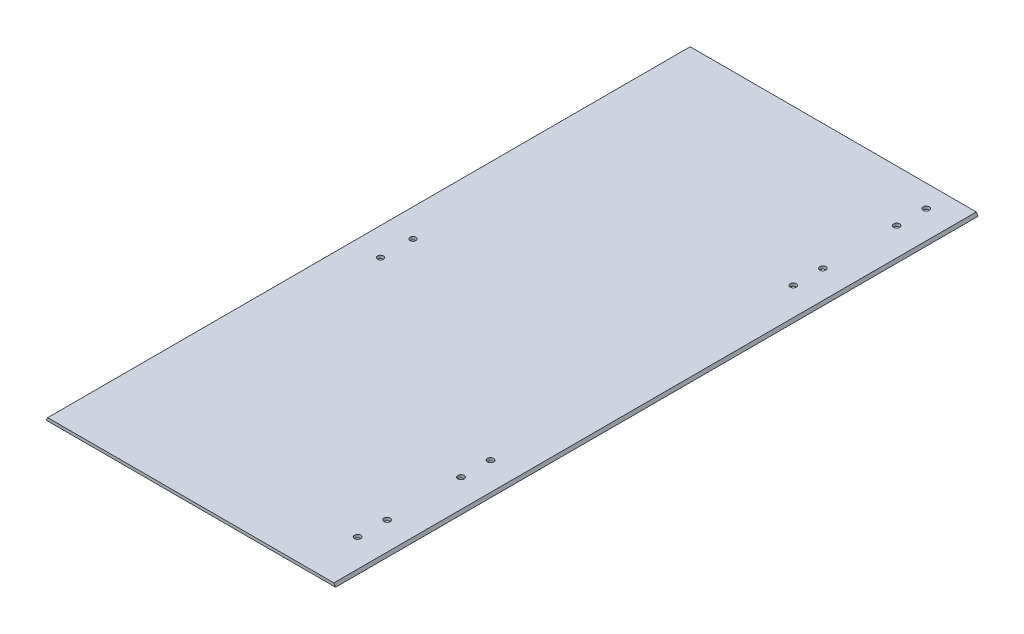
from build123d import *

# Parameters (mm, degrees)
EXTRUDE_1_DEPTH     = 435
SKETCH_3_R          = 2.1
CUT_EXTRUDE_1_DEPTH = 446.922330569
SKETCH_6_R          = 2
CUT_EXTRUDE_2_DEPTH = 446.922330569


with BuildPart() as part:
    # 草图2 → 凸台-拉伸1 (new body)
    with BuildSketch(Plane.XY):
        Polygon((-98, -1), (-96.845299462, 1), (96.915299462, 1), (98.07, -1), align=None)
    extrude(amount=-EXTRUDE_1_DEPTH)

    # 草图3 → 切除-拉伸1 (cut, through all)
    with BuildSketch(Plane(origin=(0, -1, 0), x_dir=(-1, 0, 0), z_dir=(0, -1, 0))):
        with Locations(Location((-78, 35, 0), (0, 0, 90))):
            Circle(SKETCH_3_R)
        with Locations(Location((-78, 55, 0), (0, 0, 90))):
            Circle(SKETCH_3_R)
        with Locations(Location((-78, 105, 0), (0, 0, 90))):
            Circle(SKETCH_3_R)
        with Locations(Location((-78, 125, 0), (0, 0, 90))):
            Circle(SKETCH_3_R)
        with Locations(Location((-78, 330, 0), (0, 0, 90))):
            Circle(SKETCH_3_R)
        with Locations(Location((-78, 350, 0), (0, 0, 90))):
            Circle(SKETCH_3_R)
        with Locations(Location((-78, 400, 0), (0, 0, 90))):
            Circle(SKETCH_3_R)
        with Locations(Location((-78, 420, 0), (0, 0, 90))):
            Circle(SKETCH_3_R)
    extrude(amount=-CUT_EXTRUDE_1_DEPTH, mode=Mode.SUBTRACT)

    # 草图6 → 切除-拉伸2 (cut, through all)
    with BuildSketch(Plane(origin=(0, -1, 0), x_dir=(-1, 0, 0), z_dir=(0, -1, 0))):
        with Locations(Location((78, 206.5, 0), (0, 0, 90))):
            Circle(SKETCH_6_R)
        with Locations(Location((78, 228.5, 0), (0, 0, 270))):
            Circle(SKETCH_6_R)
    extrude(amount=-CUT_EXTRUDE_2_DEPTH, mode=Mode.SUBTRACT)


solid = part.part
